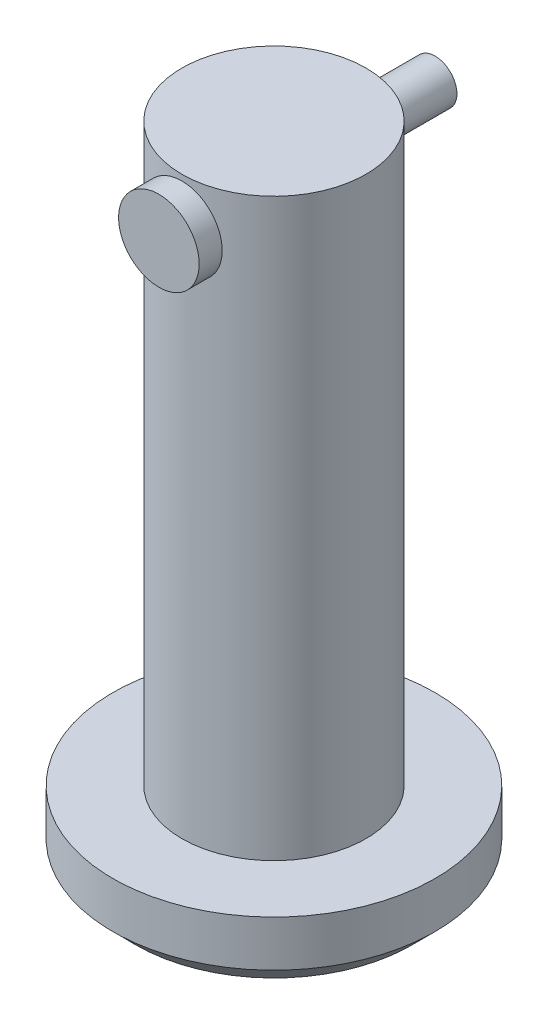
from build123d import *

# Parameters (mm, degrees)
SKETCH1_R                = 4
BOSS_EXTRUDE1_DEPTH      = 25
SKETCH2_R                = 7
BOSS_EXTRUDE2_DEPTH      = 3
CHAMFER1_SIZE            = 1
CUT_EXTRUDE1_DEPTH       = 10
CUT_EXTRUDE1_DEPTH_BACK  = 10
SKETCH3_R                = 1
BOSS_EXTRUDE3_DEPTH      = 5
BOSS_EXTRUDE3_DEPTH_BACK = 7
SKETCH4_R                = 0.95
SKETCH5_R                = 1.75
BOSS_EXTRUDE4_DEPTH      = 1


with BuildPart() as part:
    # Sketch1 → Boss-Extrude1 (new body)
    with BuildSketch(Plane(origin=(0, 0, 0), x_dir=(1, 0, 0), z_dir=(0, 1, 0))):
        with Locations(Location((0, 0, 0), (0, 0, 270))):
            Circle(SKETCH1_R)
    extrude(amount=BOSS_EXTRUDE1_DEPTH)

    # Sketch2 → Boss-Extrude2 (add)
    with BuildSketch(Plane.XZ):
        with Locations(Location((0, 0, 0), (0, 0, 270))):
            Circle(SKETCH2_R)
    extrude(amount=BOSS_EXTRUDE2_DEPTH)

    # Chamfer1
    chamfer1_edges = [part.edges().sort_by_distance(p)[0] for p in [
        (0, -3, 7),
    ]]
    chamfer(chamfer1_edges, length=CHAMFER1_SIZE)

    # Sketch3 → Cut-Extrude1 (cut, two sides: drawn at the far end of the back side and taken through both)
    with BuildSketch(Plane.XY.offset(-CUT_EXTRUDE1_DEPTH_BACK)):
        with Locations(Location((0, 23, 0), (0, 0, 180))):
            Circle(SKETCH3_R)
    extrude(amount=CUT_EXTRUDE1_DEPTH + CUT_EXTRUDE1_DEPTH_BACK, mode=Mode.SUBTRACT)


with BuildPart() as body_2:
    # Sketch4 → Boss-Extrude3 (new, two sides: drawn at the far end of the back side and taken through both)
    with BuildSketch(Plane.XY.offset(-BOSS_EXTRUDE3_DEPTH_BACK)):
        with Locations((0, 23)):
            Circle(SKETCH4_R)
    extrude(amount=BOSS_EXTRUDE3_DEPTH + BOSS_EXTRUDE3_DEPTH_BACK)

    # Sketch5 → Boss-Extrude4 (add)
    with BuildSketch(Plane.XY.offset(5)):
        with Locations((0, 23)):
            Circle(SKETCH5_R)
    extrude(amount=-BOSS_EXTRUDE4_DEPTH)


solid = Compound([part.part, body_2.part])
